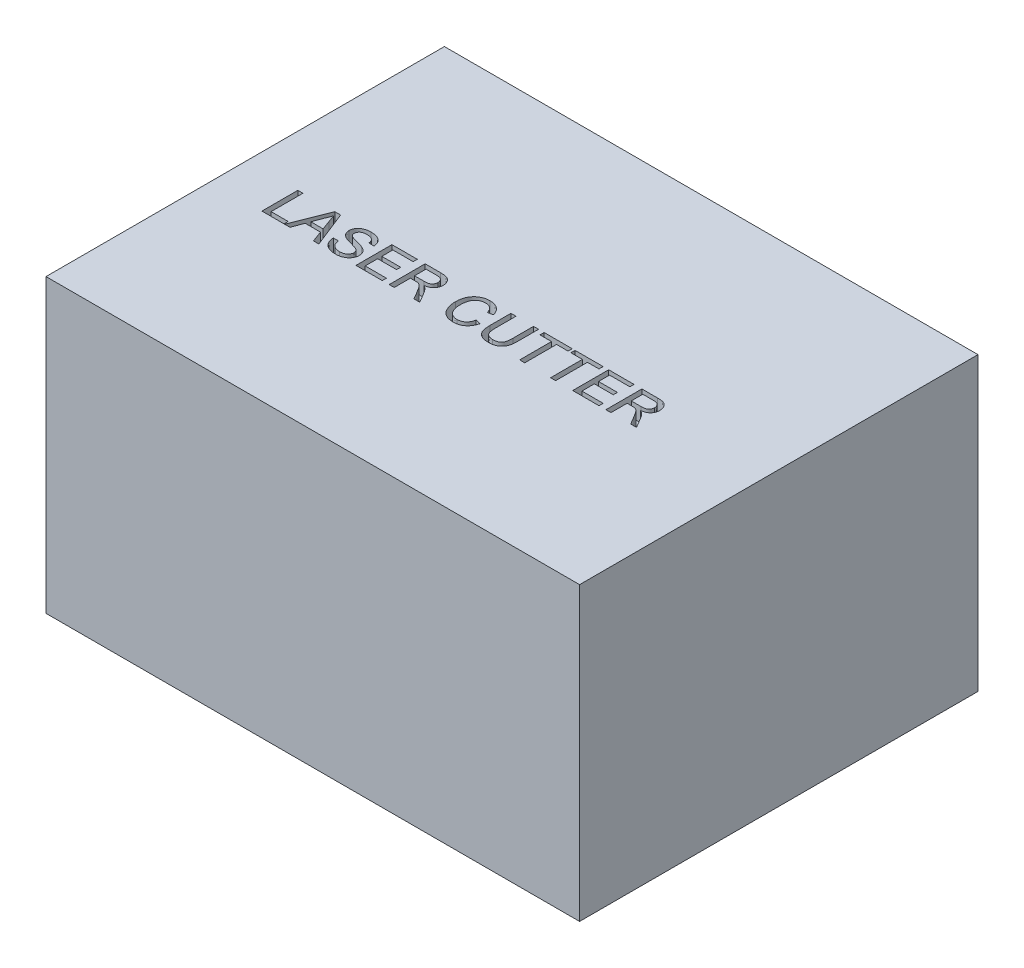
from build123d import *

# Parameters (mm, degrees)
SKETCH1_W           = 1905
SKETCH1_H           = 1422.4
BOSS_EXTRUDE1_DEPTH = 1041.4
CUT_EXTRUDE1_DEPTH  = 50.8


with BuildPart() as part:
    # Sketch1 → Boss-Extrude1 (new body)
    with BuildSketch(Plane(origin=(0, 0, 0), x_dir=(1, 0, 0), z_dir=(0, 1, 0))):
        with Locations((952.5, 711.2)):
            Rectangle(SKETCH1_W, SKETCH1_H)
    extrude(amount=BOSS_EXTRUDE1_DEPTH)

    # Sketch2 → Cut-Extrude1 (cut)
    # profile 1 of 11: a face of its own
    with BuildSketch(Plane(origin=(0, 1041.4, 0), x_dir=(1, 0, 0), z_dir=(0, 1, 0))):
        Polygon((182.897378467, 587.869249848), (182.897378467, 716.285184093), (201.007317912, 716.285184093), (201.007317912, 602.68647303), (261.922568771, 602.68647303), (261.922568771, 587.869249848), align=None)
    # profile 2 of 11: a face of its own
    with BuildSketch(Plane(origin=(0, 1041.4, 0), x_dir=(1, 0, 0), z_dir=(0, 1, 0))):
        Polygon((264.109138165, 587.869249848), (315.094791545, 716.285184093), (335.519922112, 716.285184093), (386.505575492, 587.869249848), (367.289489177, 587.869249848), (352.678060762, 627.381845001), (297.936652895, 627.381845001), (283.325224479, 587.869249848), align=None)
        with BuildLine():
            Line((303.390214205, 642.199068183), (347.224499452, 642.199068183))
            Line((347.224499452, 642.199068183), (334.748191738, 675.949409875))
            add(Edge.make_bspline(
                [(334.748191738, 675.949409875), (334.269894644, 677.253477084), (333.334733516, 679.803174704), (331.940126535, 683.507670106), (330.666036071, 687.025610989), (329.416685744, 690.306555119), (328.28887489, 693.398161507), (327.249342716, 696.279547752), (326.221254169, 698.930686841), (325.604283769, 700.643595861), (325.307356828, 701.467960911)],
                knots=[0, 0, 0, 0, 1.225184869, 2.395467751, 3.491410812, 4.525364584, 5.492066482, 6.394148129, 7.227157926, 8, 8, 8, 8], degree=3))
            add(Edge.make_bspline(
                [(325.307356828, 701.467960911), (324.816182356, 699.435149294), (323.831808147, 695.36114414), (321.770768218, 689.392180055), (319.413010122, 683.47780484), (317.498229605, 679.666621825), (316.53535491, 677.750114081)],
                knots=[0, 0, 0, 0, 0.9891762, 1.982431084, 2.985436691, 4, 4, 4, 4], degree=3))
            Line((316.53535491, 677.750114081), (303.390214205, 642.199068183))
        make_face(mode=Mode.SUBTRACT)
    # profile 3 of 11: a face of its own
    with BuildSketch(Plane(origin=(0, 1041.4, 0), x_dir=(1, 0, 0), z_dir=(0, 1, 0))):
        with BuildLine():
            Line((393.631219279, 632.320919395), (411.741158724, 632.320919395))
            add(Edge.make_bspline(
                [(411.741158724, 632.320919395), (411.940357551, 630.694895863), (412.323029225, 627.5712171), (413.393017448, 623.143872682), (414.770161329, 619.163235682), (416.48604464, 615.576476019), (418.743223757, 612.426598726), (421.462736326, 609.585457511), (424.765436332, 607.125201257), (428.493431766, 604.935734382), (432.645378274, 603.216656596), (437.077951468, 601.942275935), (441.770011839, 601.18719524), (444.982846033, 601.089830781), (446.623371632, 601.040114899)],
                knots=[0, 0, 0, 0, 1.125557648, 2.162256852, 3.1243583, 4.018160113, 4.88511607, 5.777380551, 6.711250965, 7.707237736, 8.743031335, 9.791730543, 10.872421559, 12, 12, 12, 12], degree=3))
            add(Edge.make_bspline(
                [(446.623371632, 601.040114899), (448.0750955, 601.066984762), (450.905675933, 601.119375791), (455.000426917, 601.748721848), (458.853599492, 602.641432323), (462.393482097, 603.991796681), (465.607016465, 605.631562418), (468.397611047, 607.614897529), (470.780072259, 609.851554717), (472.645712079, 612.40044629), (474.11132147, 615.071258414), (475.186497467, 617.816577825), (475.826957773, 620.62116674), (475.908569072, 622.508238756), (475.949125846, 623.446020093)],
                knots=[0, 0, 0, 0, 1.267006637, 2.470417599, 3.611360613, 4.716023143, 5.771382139, 6.754486395, 7.697536124, 8.612899418, 9.501261124, 10.352596716, 11.181322154, 12, 12, 12, 12], degree=3))
            add(Edge.make_bspline(
                [(475.949125846, 623.446020093), (475.905769901, 624.374302245), (475.821030769, 626.188628388), (475.268809314, 628.830060612), (474.219234405, 631.24773834), (472.857290344, 633.540339907), (470.962593615, 635.636427343), (468.568858118, 637.567784944), (465.623343853, 639.318772449), (463.424960595, 640.27771527), (462.263773879, 640.784229163)],
                knots=[0, 0, 0, 0, 0.942140154, 1.841411588, 2.718743672, 3.605002079, 4.535543111, 5.568170452, 6.715506882, 8, 8, 8, 8], degree=3))
            add(Edge.make_bspline(
                [(462.263773879, 640.784229163), (461.811358362, 640.969885562), (460.789269522, 641.389317092), (459.037457211, 641.944572222), (456.958710052, 642.662573762), (454.503087815, 643.401998492), (451.683736524, 644.184206442), (448.505350117, 645.069547249), (444.969704624, 646.011058737), (441.177077055, 647.013195163), (437.347678944, 648.032214228), (433.689136421, 649.052187586), (430.323103372, 650.087591197), (427.222007443, 651.084541925), (424.401836195, 652.08560575), (421.854585333, 653.063375696), (419.577079055, 653.998014108), (418.186064922, 654.685239397), (417.529136529, 655.009792392)],
                knots=[0, 0, 0, 0, 0.499201778, 1.127787504, 1.87543728, 2.745208432, 3.745951656, 4.863402235, 6.114490242, 7.482339553, 8.869366102, 10.161191451, 11.360587006, 12.46547846, 13.487450326, 14.41601931, 15.251940103, 16, 16, 16, 16], degree=3))
            add(Edge.make_bspline(
                [(417.529136529, 655.009792392), (416.017727529, 655.826299072), (413.100314813, 657.402369461), (409.173800414, 660.220387726), (405.865313423, 663.34750057), (403.188811698, 666.779173547), (401.091342029, 670.457368828), (399.676188415, 674.388339379), (398.706925011, 678.500730742), (398.61634482, 681.328644552), (398.570293673, 682.766361513)],
                knots=[0, 0, 0, 0, 1.158441928, 2.236094408, 3.251151369, 4.220012324, 5.163146324, 6.095083285, 7.031536583, 8, 8, 8, 8], degree=3))
            add(Edge.make_bspline(
                [(398.570293673, 682.766361513), (398.631412706, 684.358390196), (398.75297802, 687.524923693), (399.831328976, 692.171614198), (401.551319381, 696.642966437), (403.509190816, 700.192838568), (405.418548125, 702.877235987), (407.001419838, 704.810489936), (408.776920048, 706.597523308), (410.690369521, 708.263281883), (412.775973106, 709.7828773), (414.98198677, 711.21876302), (417.388255885, 712.452941254), (420.769421842, 714.023771576), (425.292607189, 715.592392547), (430.986731799, 716.959246754), (436.979610982, 717.764158778), (441.064498219, 717.874958549), (443.150584948, 717.931542224)],
                knots=[0, 0, 0, 0, 1.199927478, 2.386647047, 3.578628709, 4.806592355, 5.433127754, 6.062729195, 6.689531802, 7.331674828, 7.974827539, 8.635320743, 9.315455226, 10.01318112, 11.447700238, 12.918145351, 14.426146008, 16, 16, 16, 16], degree=3))
            add(Edge.make_bspline(
                [(443.150584948, 717.931542224), (445.433945437, 717.879222506), (449.880088271, 717.777345933), (456.340459481, 716.929751404), (462.366217233, 715.474208561), (467.091823209, 713.844874383), (470.585408444, 712.195394597), (473.067348673, 710.90832227), (475.371079997, 709.420232197), (477.517340645, 707.809885939), (479.526066474, 706.078018933), (481.34562872, 704.183435787), (483.05503785, 702.190776248), (485.063831784, 699.329941484), (487.229737514, 695.543642859), (489.102457836, 690.638342599), (490.389038542, 685.461200925), (490.639308095, 681.88211034), (490.766349028, 680.065305204)],
                knots=[0, 0, 0, 0, 1.607600973, 3.130308851, 4.577334065, 5.967726088, 6.640410691, 7.296826776, 7.935019992, 8.569057421, 9.185393759, 9.8003086, 10.417295362, 11.032210203, 12.259799365, 13.477607022, 14.719591916, 16, 16, 16, 16], degree=3))
            Line((490.766349028, 680.065305204), (472.656409583, 680.065305204))
            add(Edge.make_bspline(
                [(472.656409583, 680.065305204), (472.541341697, 680.984843407), (472.316187946, 682.784107141), (471.757611379, 685.388812083), (470.974599433, 687.807944824), (470.057452478, 690.064065416), (468.945678355, 692.133707721), (467.649671434, 694.036744833), (466.153649099, 695.750755727), (464.496105579, 697.321031143), (462.626602128, 698.688302695), (460.554744838, 699.875136377), (458.277036347, 700.877739073), (455.795483311, 701.69890338), (453.109594432, 702.335602064), (450.213260624, 702.803969771), (447.107601365, 703.043841844), (444.968782213, 703.090412847), (443.870866631, 703.114319042)],
                knots=[0, 0, 0, 0, 1.074487479, 2.102453544, 3.083708351, 4.020042547, 4.923259678, 5.803182661, 6.684453325, 7.556870173, 8.445961597, 9.363679789, 10.320905216, 11.327237703, 12.390948353, 13.519046902, 14.726457512, 16, 16, 16, 16], degree=3))
            add(Edge.make_bspline(
                [(443.870866631, 703.114319042), (442.729634593, 703.105716975), (440.520490041, 703.089065487), (437.326921065, 702.785529681), (434.366895425, 702.369067787), (431.64549728, 701.75475108), (429.171641574, 700.950608448), (426.908612742, 700.022008232), (424.919744047, 698.845229228), (423.158671529, 697.53445047), (421.639523433, 696.084146184), (420.33024281, 694.555876116), (419.172285225, 692.994541939), (418.272526639, 691.314800105), (417.539987913, 689.580264986), (417.067419944, 687.758333005), (416.732830782, 685.882705169), (416.698007951, 684.602926685), (416.680233118, 683.94968142)],
                knots=[0, 0, 0, 0, 1.464176581, 2.834285765, 4.113735764, 5.29917439, 6.409476712, 7.449999357, 8.431575861, 9.367089851, 10.262376129, 11.120706676, 11.948504824, 12.751342953, 13.560717798, 14.359016663, 15.162382702, 16, 16, 16, 16], degree=3))
            add(Edge.make_bspline(
                [(416.680233118, 683.94968142), (416.727033464, 682.844847167), (416.817868621, 680.700465751), (417.745428383, 677.653946165), (419.172021787, 674.876846167), (420.577443594, 673.365840241), (421.284891016, 672.605244921)],
                knots=[0, 0, 0, 0, 1.050964922, 2.039826012, 3.013306874, 4, 4, 4, 4], degree=3))
            add(Edge.make_bspline(
                [(421.284891016, 672.605244921), (421.730858329, 672.225135774), (422.717087506, 671.384547865), (424.552118918, 670.272128187), (426.827285721, 669.148169874), (429.557790205, 668.030868335), (432.73893444, 666.906659647), (436.365587178, 665.749148555), (440.451561912, 664.59952363), (444.872338683, 663.491669802), (449.338354041, 662.379362317), (453.582570076, 661.27129416), (457.479478812, 660.221150471), (461.022897519, 659.196907321), (464.216493748, 658.201460899), (467.049168581, 657.213955319), (469.543839428, 656.305700672), (471.072120042, 655.666669374), (471.781781826, 655.369933233)],
                knots=[0, 0, 0, 0, 0.523891492, 1.158553688, 1.913783773, 2.794766643, 3.797521443, 4.933638669, 6.202080764, 7.596537849, 9.013317056, 10.322179469, 11.523240428, 12.626146501, 13.623953177, 14.517289671, 15.311498917, 16, 16, 16, 16], degree=3))
            add(Edge.make_bspline(
                [(471.781781826, 655.369933233), (472.705087826, 654.944229875), (474.517382774, 654.108645523), (477.084741246, 652.682010941), (479.480365234, 651.20052773), (481.684899698, 649.624309359), (483.691216311, 647.950040291), (485.521748039, 646.196903968), (487.187550649, 644.3747533), (488.621409165, 642.425268857), (489.908867002, 640.427257582), (491.035478341, 638.352794701), (491.942604154, 636.189680693), (492.738210073, 633.963989891), (493.310478936, 631.650966139), (493.75925315, 629.27397252), (494.021015645, 626.821836474), (494.046272428, 625.161585028), (494.059065291, 624.32064785)],
                knots=[0, 0, 0, 0, 1.198900896, 2.353241543, 3.461831299, 4.520043694, 5.547003373, 6.541368882, 7.508191797, 8.454912692, 9.392021408, 10.310662301, 11.235020644, 12.156274873, 13.095836685, 14.042125239, 15.00831306, 16, 16, 16, 16], degree=3))
            add(Edge.make_bspline(
                [(494.059065291, 624.32064785), (493.992047447, 622.6423658), (493.858994752, 619.310418118), (492.713363065, 614.398973136), (490.913636277, 609.639810364), (488.803010816, 605.863152543), (486.807831816, 602.978334817), (485.131787343, 600.904859678), (483.273150383, 598.987615946), (481.277678692, 597.166540014), (479.129879314, 595.47878778), (476.811644968, 593.923784536), (474.34744352, 592.485342837), (470.828625819, 590.732517392), (466.15505133, 588.898895533), (460.201855659, 587.371917345), (453.927908491, 586.381328837), (449.619829083, 586.276433942), (447.420826351, 586.222891717)],
                knots=[0, 0, 0, 0, 1.197055466, 2.376552968, 3.581957237, 4.820753935, 5.454298064, 6.085440993, 6.72202542, 7.359198513, 8.013298489, 8.67051481, 9.351020706, 10.049282741, 11.476266879, 12.925760103, 14.430794493, 16, 16, 16, 16], degree=3))
            add(Edge.make_bspline(
                [(447.420826351, 586.222891717), (446.022654775, 586.234430067), (443.283836389, 586.257032045), (439.25944866, 586.530749137), (435.402804346, 586.926694362), (431.717688206, 587.516459183), (428.2156564, 588.290198603), (424.884138223, 589.21931011), (421.715237036, 590.289373561), (418.720025081, 591.547749633), (415.906321113, 593.009845168), (413.223531892, 594.587076315), (410.715509391, 596.374941736), (408.376973908, 598.345347854), (406.148671932, 600.44137139), (404.122959947, 602.748612226), (402.23096892, 605.199598324), (400.515930301, 607.816762044), (398.983804392, 610.565862226), (397.605986692, 613.400730688), (396.445156002, 616.341932186), (395.509636924, 619.374601953), (394.717204899, 622.478445325), (394.167671605, 625.679358465), (393.763636216, 628.967291661), (393.675618972, 631.196440567), (393.631219279, 632.320919395)],
                knots=[0, 0, 0, 0, 1.259822038, 2.467811403, 3.633536148, 4.752793854, 5.829021491, 6.863980041, 7.868367876, 8.841470325, 9.788447787, 10.724101269, 11.643985084, 12.560193707, 13.478453146, 14.398077254, 15.323914234, 16.266973849, 17.21495974, 18.158525798, 19.105629373, 20.061269543, 21.017128399, 21.990322895, 22.986232211, 24, 24, 24, 24], degree=3))
        make_face()
    # profile 4 of 11: a face of its own
    with BuildSketch(Plane(origin=(0, 1041.4, 0), x_dir=(1, 0, 0), z_dir=(0, 1, 0))):
        Polygon((518.754437261, 587.869249848), (518.754437261, 716.285184093), (609.304134485, 716.285184093), (609.304134485, 701.467960911), (536.864376706, 701.467960911), (536.864376706, 661.955365759), (604.365060091, 661.955365759), (604.365060091, 647.138142577), (536.864376706, 647.138142577), (536.864376706, 602.68647303), (612.596850748, 602.68647303), (612.596850748, 587.869249848), align=None)
    # profile 5 of 11: a face of its own
    with BuildSketch(Plane(origin=(0, 1041.4, 0), x_dir=(1, 0, 0), z_dir=(0, 1, 0))):
        with BuildLine():
            Line((637.292222718, 587.869249848), (637.292222718, 716.285184093))
            Line((637.292222718, 716.285184093), (693.011155725, 716.285184093))
            add(Edge.make_bspline(
                [(693.011155725, 716.285184093), (694.323165987, 716.27490395), (696.862408284, 716.255007936), (700.544833911, 716.114166751), (703.982009073, 715.810550104), (707.180253586, 715.482231015), (710.138999212, 714.978305064), (712.855193495, 714.400313383), (715.333030101, 713.712494543), (717.583586459, 712.90012747), (719.671612023, 711.981055827), (721.607054001, 710.847069804), (723.470366223, 709.604462916), (725.19239467, 708.144585264), (726.818558012, 706.54615436), (728.347349069, 704.78745092), (729.756135307, 702.853212977), (731.493704418, 700.084917354), (733.357761814, 696.398130544), (734.910814417, 691.679842271), (735.912194953, 686.744340518), (736.019345531, 683.371496818), (736.073710598, 681.660214643)],
                knots=[0, 0, 0, 0, 1.242255013, 2.404239178, 3.487702428, 4.508875116, 5.447164253, 6.327763259, 7.137389581, 7.87956647, 8.591787438, 9.293660819, 10.000726923, 10.709654955, 11.427269343, 12.158170644, 12.913245971, 13.690346794, 15.251572448, 16.809945773, 18.381459854, 20, 20, 20, 20], degree=3))
            add(Edge.make_bspline(
                [(736.073710598, 681.660214643), (736.048581831, 680.561724104), (735.998950793, 678.392129958), (735.618772045, 675.202245829), (734.930869296, 672.154439815), (734.048769609, 669.222019778), (732.841444238, 666.446533423), (731.4428102, 663.771290595), (729.710101477, 661.269787351), (727.770142456, 658.875412672), (725.545529685, 656.639447671), (723.016693296, 654.642560466), (720.208701062, 652.846356428), (717.108328467, 651.300393525), (713.751263917, 649.887310035), (710.095385473, 648.749427124), (706.155447956, 647.820258472), (703.424100126, 647.370319154), (702.014676756, 647.138142577)],
                knots=[0, 0, 0, 0, 0.982609109, 1.940720374, 2.867584677, 3.775009516, 4.675469332, 5.571146231, 6.471115823, 7.392408543, 8.32534739, 9.286126426, 10.269214477, 11.301811357, 12.381622301, 13.524260118, 14.722474812, 16, 16, 16, 16], degree=3))
            add(Edge.make_bspline(
                [(702.014676756, 647.138142577), (703.048542194, 646.615856562), (705.011889881, 645.624016617), (707.730169082, 644.068820198), (710.034360265, 642.479792691), (711.369294977, 641.343273509), (711.995722928, 640.809953509)],
                knots=[0, 0, 0, 0, 1.172304973, 2.226249348, 3.167654437, 4, 4, 4, 4], degree=3))
            add(Edge.make_bspline(
                [(711.995722928, 640.809953509), (713.208836045, 639.620748142), (715.700656569, 637.178035833), (719.134493487, 633.017381213), (722.46371631, 628.385934178), (724.486470196, 625.038771709), (725.526728819, 623.317398364)],
                knots=[0, 0, 0, 0, 0.918110279, 1.885863737, 2.912745394, 4, 4, 4, 4], degree=3))
            Line((725.526728819, 623.317398364), (746.594968032, 587.869249848))
            Line((746.594968032, 587.869249848), (725.835420969, 587.869249848))
            Line((725.835420969, 587.869249848), (709.83487788, 614.982710324))
            add(Edge.make_bspline(
                [(709.83487788, 614.982710324), (709.259578721, 615.934018675), (708.144743413, 617.777498055), (706.534403751, 620.469810946), (704.955518657, 622.948513937), (703.491129739, 625.284449709), (702.08180964, 627.435210501), (700.741175692, 629.408267635), (699.506122735, 631.229505044), (697.976349975, 633.349899347), (696.195948562, 635.69613532), (694.11834227, 638.112315321), (692.139845092, 640.03870345), (689.703289305, 641.927731929), (686.685246341, 643.694600544), (684.119852851, 644.506428133), (682.875763479, 644.900124492)],
                knots=[0, 0, 0, 0, 1.130940588, 2.191577161, 3.191089816, 4.120344442, 4.99615009, 5.80661983, 6.546979556, 7.234477901, 8.466216387, 9.541989141, 10.473533583, 11.269175393, 12.675684693, 14, 14, 14, 14], degree=3))
            add(Edge.make_bspline(
                [(682.875763479, 644.900124492), (682.353789689, 644.994254106), (681.162107877, 645.209154838), (679.138635133, 645.349506848), (676.686949662, 645.498471729), (674.910171419, 645.494131392), (673.949415486, 645.491784445)],
                knots=[0, 0, 0, 0, 0.709978628, 1.620902492, 2.713552433, 4, 4, 4, 4], degree=3))
            Line((673.949415486, 645.491784445), (655.402162163, 645.491784445))
            Line((655.402162163, 645.491784445), (655.402162163, 587.869249848))
            Line((655.402162163, 587.869249848), (637.292222718, 587.869249848))
        make_face()
        with BuildLine():
            Line((655.402162163, 660.309007627), (689.7956125, 660.309007627))
            add(Edge.make_bspline(
                [(689.7956125, 660.309007627), (691.520230378, 660.33599091), (694.744241743, 660.386433625), (699.252511599, 660.817161395), (703.094560608, 661.501606114), (706.346340593, 662.499948895), (709.078349062, 663.885980201), (711.454428735, 665.575118349), (713.428980854, 667.69093972), (715.071604246, 670.078193668), (716.348449107, 672.705247474), (717.26950409, 675.464582334), (717.872350596, 678.333007824), (717.933027733, 680.285218503), (717.963771154, 681.274349456)],
                knots=[0, 0, 0, 0, 1.546323217, 2.890706218, 4.056530419, 5.041445823, 5.928701482, 6.793137403, 7.641659452, 8.509781392, 9.383301667, 10.251423607, 11.114044887, 12, 12, 12, 12], degree=3))
            add(Edge.make_bspline(
                [(717.963771154, 681.274349456), (717.939869428, 681.995166794), (717.893052969, 683.407036208), (717.647625606, 685.479268518), (717.170456544, 687.448368191), (716.540355968, 689.32474411), (715.698413737, 691.094653162), (714.698220713, 692.771810186), (713.504681665, 694.3469197), (712.13755136, 695.824779729), (710.567837324, 697.169487929), (708.774854864, 698.329679445), (706.772745127, 699.315591943), (704.559180985, 700.098078009), (702.141135572, 700.723939488), (699.504843486, 701.140304944), (696.662361054, 701.4415856), (694.69268557, 701.459004888), (693.679988716, 701.467960911)],
                knots=[0, 0, 0, 0, 0.965208469, 1.890559848, 2.786986821, 3.67262109, 4.535197034, 5.405224191, 6.282113641, 7.175449223, 8.095446547, 9.040936516, 10.026471658, 11.075712529, 12.17809725, 13.364958037, 14.645208957, 16, 16, 16, 16], degree=3))
            Line((693.679988716, 701.467960911), (655.402162163, 701.467960911))
            Line((655.402162163, 701.467960911), (655.402162163, 660.309007627))
        make_face(mode=Mode.SUBTRACT)
    # profile 6 of 11: a face of its own
    with BuildSketch(Plane(origin=(0, 1041.4, 0), x_dir=(1, 0, 0), z_dir=(0, 1, 0))):
        with BuildLine():
            Line((902.355881864, 633.195547152), (920.465821309, 628.97675444))
            add(Edge.make_bspline(
                [(920.465821309, 628.97675444), (920.012116773, 627.279360125), (919.124614389, 623.959046172), (917.36991437, 619.207309369), (915.400478791, 614.748007065), (913.168520228, 610.592885856), (910.6496101, 606.765835106), (907.910489349, 603.217669832), (904.842665258, 600.022798416), (901.558699958, 597.107484894), (898.033024194, 594.536186147), (894.308145537, 592.315822508), (890.40206925, 590.426743765), (886.299008188, 588.873281401), (881.996302303, 587.704167782), (877.516106296, 586.852049283), (872.845356213, 586.327193917), (869.661612798, 586.258095165), (868.039604564, 586.222891717)],
                knots=[0, 0, 0, 0, 1.145254194, 2.240259345, 3.299159039, 4.322497661, 5.312016644, 6.284080175, 7.241264552, 8.196044782, 9.144516039, 10.082428046, 11.020306713, 11.970622414, 12.939253955, 13.924100776, 14.94240044, 16, 16, 16, 16], degree=3))
            add(Edge.make_bspline(
                [(868.039604564, 586.222891717), (866.375392699, 586.247069727), (863.119495175, 586.294372072), (858.349793014, 586.679116778), (853.813337897, 587.346396594), (849.518601551, 588.273486401), (845.451128404, 589.419775313), (841.627785158, 590.861908338), (838.055268532, 592.589479954), (834.703778989, 594.554175357), (831.587551449, 596.786157808), (828.635721808, 599.225192165), (825.919950675, 601.938422351), (823.372333502, 604.861786484), (821.048358315, 608.033847799), (818.862525561, 611.41151251), (816.921524476, 615.054294928), (815.153423061, 618.894657773), (813.601522657, 622.895419434), (812.228633624, 626.977553817), (811.106221786, 631.149195015), (810.139897623, 635.375239393), (809.437909942, 639.691246208), (808.880553457, 644.064832202), (808.574107656, 648.522811241), (808.533782622, 651.519432205), (808.513468378, 653.029017765)],
                knots=[0, 0, 0, 0, 1.180702053, 2.309949215, 3.392367133, 4.431746864, 5.425408375, 6.388154007, 7.326956194, 8.237882283, 9.141054626, 10.043899035, 10.951650021, 11.86168169, 12.792564695, 13.739356664, 14.713891418, 15.718426911, 16.737522708, 17.757217648, 18.772674716, 19.801476837, 20.831699174, 21.873853055, 22.928926693, 24, 24, 24, 24], degree=3))
            add(Edge.make_bspline(
                [(808.513468378, 653.029017765), (808.542522026, 654.658676251), (808.599924697, 657.878469815), (808.923961844, 662.629368679), (809.51910063, 667.214567283), (810.345575298, 671.63708167), (811.391396388, 675.900493444), (812.682345293, 680.006879718), (814.202091563, 683.950986417), (815.946002006, 687.737162708), (817.925662854, 691.323144879), (820.081989331, 694.714030695), (822.466418102, 697.854143319), (825.008254403, 700.803475467), (827.770982298, 703.512917449), (830.74616563, 705.988606785), (833.908135785, 708.2531249), (837.256431233, 710.28544892), (840.747285854, 712.068706914), (844.328849223, 713.657070348), (848.015366739, 714.958950093), (851.777610651, 716.041410767), (855.623680728, 716.903150018), (859.56256373, 717.479397744), (863.590620065, 717.854925408), (866.306650236, 717.905818424), (867.679463723, 717.931542224)],
                knots=[0, 0, 0, 0, 1.185634383, 2.342514083, 3.462112933, 4.547331452, 5.613960142, 6.653690668, 7.676612054, 8.686959706, 9.683658101, 10.654407272, 11.607580201, 12.5494388, 13.484601218, 14.419076806, 15.362504069, 16.311442244, 17.265594461, 18.212500624, 19.159571152, 20.107257795, 21.059246075, 22.024387127, 23.001429356, 24, 24, 24, 24], degree=3))
            add(Edge.make_bspline(
                [(867.679463723, 717.931542224), (869.215457073, 717.90258951), (872.23460409, 717.845680082), (876.664664429, 717.377588815), (880.90750557, 716.593587218), (884.981512507, 715.565051266), (888.844328553, 714.156771442), (892.537891242, 712.482488589), (896.025456942, 710.471040551), (899.334161888, 708.17770556), (902.410145445, 705.598254169), (905.296452734, 702.794308766), (907.875395305, 699.69579117), (910.249114963, 696.377691029), (912.342926571, 692.793997617), (914.233859342, 688.975956891), (915.860006489, 684.895186086), (916.730076199, 682.052816346), (917.173105046, 680.605516465)],
                knots=[0, 0, 0, 0, 1.098391872, 2.158997981, 3.181470371, 4.182549255, 5.160268219, 6.118029851, 7.079534476, 8.035645336, 8.993622929, 9.94770573, 10.909620999, 11.872786677, 12.862530088, 13.874594564, 14.917769567, 16, 16, 16, 16], degree=3))
            Line((917.173105046, 680.605516465), (899.063165601, 676.721140249))
            add(Edge.make_bspline(
                [(899.063165601, 676.721140249), (898.707514659, 677.831868597), (898.011395721, 680.005907653), (896.775368452, 683.104299675), (895.440500212, 685.980619771), (893.974993344, 688.615316011), (892.375671787, 691.009019483), (890.679363668, 693.190822094), (888.845427144, 695.120000164), (886.911166016, 696.841035743), (884.826631985, 698.307193359), (882.640695579, 699.606450289), (880.307266356, 700.681387272), (877.859912414, 701.590561898), (875.275758596, 702.282541755), (872.565327919, 702.769376881), (869.726238936, 703.0511332), (867.791559256, 703.092977604), (866.804835965, 703.114319042)],
                knots=[0, 0, 0, 0, 1.235697765, 2.418642872, 3.532555292, 4.594392283, 5.610119701, 6.580908344, 7.519430642, 8.427315627, 9.319973334, 10.216139639, 11.118687699, 12.038725643, 12.980015607, 13.949697744, 14.954307006, 16, 16, 16, 16], degree=3))
            add(Edge.make_bspline(
                [(866.804835965, 703.114319042), (865.671987359, 703.097882534), (863.444008464, 703.065556773), (860.170839444, 702.711754907), (857.027458727, 702.190639282), (854.037293821, 701.409181604), (851.183982331, 700.434907093), (848.484456309, 699.221762942), (845.915752381, 697.799815696), (843.506538593, 696.160526387), (841.277062209, 694.317649721), (839.166821691, 692.369440741), (837.277131998, 690.225039431), (835.535933602, 687.955155195), (833.99393014, 685.519677536), (832.605868713, 682.951780607), (831.380597155, 680.230418477), (830.044967954, 676.4003074), (828.68311497, 671.467212914), (827.501705826, 665.430704167), (826.749176055, 659.299090638), (826.665419211, 655.174855628), (826.623407822, 653.106190803)],
                knots=[0, 0, 0, 0, 0.935256702, 1.839373932, 2.716087708, 3.564631604, 4.388828665, 5.203538865, 6.005592122, 6.810952829, 7.606223804, 8.392839071, 9.180346482, 9.963639178, 10.753404291, 11.558266631, 12.372976832, 13.215232055, 14.905983541, 16.594894834, 18.292041732, 20, 20, 20, 20], degree=3))
            add(Edge.make_bspline(
                [(826.623407822, 653.106190803), (826.670790706, 650.505190976), (826.762717791, 645.459015767), (827.669812172, 638.146274363), (829.052801946, 631.325455007), (830.721871354, 626.003856867), (832.396115668, 622.078545882), (833.750160347, 619.32959399), (835.295748329, 616.785847269), (836.994435209, 614.43285947), (838.868101855, 612.277494191), (840.8906443, 610.30830198), (843.062514323, 608.506334571), (845.409446567, 606.955945333), (847.84110466, 605.579334881), (850.326803037, 604.355226579), (852.86810672, 603.319929955), (855.475268796, 602.515690511), (858.111677735, 601.820715821), (860.806370865, 601.366725736), (863.558579765, 601.110508035), (865.406619989, 601.06376741), (866.341797741, 601.040114899)],
                knots=[0, 0, 0, 0, 2.10686522, 4.087509323, 5.961373225, 7.741398778, 8.594514555, 9.418024779, 10.222433421, 11.003575649, 11.767087398, 12.533660211, 13.289033706, 14.050297079, 14.809623433, 15.552362432, 16.294320901, 17.0305302, 17.761969017, 18.502233515, 19.242073914, 20, 20, 20, 20], degree=3))
            add(Edge.make_bspline(
                [(866.341797741, 601.040114899), (867.457804337, 601.063519905), (869.662311971, 601.109753067), (872.894400083, 601.514434535), (876.010088465, 602.110785611), (878.97163099, 603.03101554), (881.818863751, 604.157729272), (884.528458553, 605.547164353), (887.091894142, 607.218249226), (889.539322152, 609.115609132), (891.825609851, 611.274480473), (893.920869616, 613.677470334), (895.800554356, 616.335533592), (897.543495123, 619.206012214), (899.007885703, 622.374657997), (900.364257151, 625.74702756), (901.494483823, 629.378548792), (902.064624483, 631.904937128), (902.355881864, 633.195547152)],
                knots=[0, 0, 0, 0, 1.013374089, 2.001772144, 2.95501459, 3.891367103, 4.814208647, 5.733921849, 6.652182523, 7.590185968, 8.54346024, 9.504121027, 10.481158517, 11.497760682, 12.549996529, 13.647863555, 14.798406869, 16, 16, 16, 16], degree=3))
        make_face()
    # profile 7 of 11: a face of its own
    with BuildSketch(Plane(origin=(0, 1041.4, 0), x_dir=(1, 0, 0), z_dir=(0, 1, 0))):
        with BuildLine():
            Line((1024.186383584, 716.285184093), (1042.296323028, 716.285184093))
            Line((1042.296323028, 716.285184093), (1042.296323028, 642.404862949))
            add(Edge.make_bspline(
                [(1042.296323028, 642.404862949), (1042.277529335, 640.835545533), (1042.240956778, 637.781651271), (1042.072707274, 633.327892981), (1041.744949635, 629.121608123), (1041.243159958, 625.169599286), (1040.675885007, 621.454725604), (1039.920362804, 617.997296013), (1039.053840769, 614.783356489), (1038.056826528, 611.791192976), (1036.850033466, 609.000591151), (1035.471268827, 606.351793587), (1033.863406821, 603.837066715), (1032.03061751, 601.460227272), (1029.963176423, 599.234267181), (1027.717537366, 597.102125988), (1025.234420472, 595.122417191), (1022.541141823, 593.272478827), (1019.63435684, 591.593513456), (1016.501340258, 590.144963808), (1013.145914012, 588.950668629), (1009.583229508, 587.934640737), (1005.795500936, 587.1813651), (1001.794879572, 586.609991238), (997.576068834, 586.273916882), (994.689735344, 586.240151986), (993.214271238, 586.222891717)],
                knots=[0, 0, 0, 0, 1.311435591, 2.552055809, 3.723716842, 4.835547674, 5.880436826, 6.862821995, 7.791032428, 8.661143393, 9.495683908, 10.328993084, 11.1538804, 11.986573222, 12.833449924, 13.690091648, 14.571895854, 15.484149563, 16.418232274, 17.373591634, 18.364096258, 19.391643703, 20.466661433, 21.588422397, 22.767226238, 24, 24, 24, 24], degree=3))
            add(Edge.make_bspline(
                [(993.214271238, 586.222891717), (991.773300557, 586.244102746), (988.965681613, 586.28543078), (984.851362796, 586.564890837), (980.93774162, 587.060124636), (977.213006737, 587.710046992), (973.689660785, 588.590863605), (970.372934647, 589.668990998), (967.251504618, 590.930128464), (964.324997478, 592.36500434), (961.627624596, 594.02164493), (959.111699485, 595.829932705), (956.788471341, 597.809557626), (954.679522084, 599.97836273), (952.759847824, 602.30368902), (951.056203508, 604.810387951), (949.564509693, 607.502930336), (948.247256847, 610.374226069), (947.099569968, 613.466540437), (946.174120776, 616.822016673), (945.336866667, 620.432042147), (944.694257067, 624.309732345), (944.129793764, 628.450218146), (943.802457834, 632.865736188), (943.553060597, 637.54868973), (943.527797501, 640.7581215), (943.514835148, 642.404862949)],
                knots=[0, 0, 0, 0, 1.192889473, 2.324252067, 3.41162405, 4.457325556, 5.452435892, 6.415456921, 7.342133401, 8.237363544, 9.110250727, 9.959377435, 10.800155199, 11.633438097, 12.46053001, 13.293359256, 14.138649731, 15.005774073, 15.906391469, 16.865847877, 17.8852706, 18.972920589, 20.118424796, 21.343408205, 22.636917643, 24, 24, 24, 24], degree=3))
            Line((943.514835148, 642.404862949), (943.514835148, 716.285184093))
            Line((943.514835148, 716.285184093), (961.624774592, 716.285184093))
            Line((961.624774592, 716.285184093), (961.624774592, 643.25376636))
            add(Edge.make_bspline(
                [(961.624774592, 643.25376636), (961.636607846, 641.924610476), (961.659440282, 639.359984593), (961.778565338, 635.6448359), (962.016794624, 632.197200366), (962.311309113, 629.011814774), (962.716212021, 626.100182151), (963.234733744, 623.466566678), (963.816342754, 621.101999547), (964.687294523, 618.336751684), (966.132992116, 615.249934411), (968.411308144, 611.978160556), (971.191306759, 609.135780686), (974.499587424, 606.788423409), (978.256511787, 604.923273392), (982.436753934, 603.637229433), (986.990720887, 602.810177011), (990.157797965, 602.728704031), (991.799432219, 602.68647303)],
                knots=[0, 0, 0, 0, 1.090245215, 2.103644224, 3.048223674, 3.924421557, 4.727106666, 5.45815927, 6.12513286, 6.723455763, 7.834131158, 8.905266051, 9.9795367, 11.078391299, 12.21701853, 13.404826756, 14.65480846, 16, 16, 16, 16], degree=3))
            add(Edge.make_bspline(
                [(991.799432219, 602.68647303), (993.206432049, 602.710425794), (995.923206324, 602.756676155), (999.840717627, 603.129669283), (1003.432138442, 603.809643577), (1006.727275689, 604.685908659), (1009.702940898, 605.875922246), (1012.377328108, 607.317691174), (1014.741053313, 609.018974285), (1016.811077958, 611.02586239), (1018.594676803, 613.427481131), (1020.097927099, 616.289628093), (1021.378515773, 619.614797571), (1022.427941777, 623.413966703), (1023.193120348, 627.705179656), (1023.791285261, 632.460798379), (1024.104933507, 637.701730288), (1024.158451987, 641.349811988), (1024.186383584, 643.25376636)],
                knots=[0, 0, 0, 0, 1.111629428, 2.146443922, 3.104513091, 3.997025448, 4.836178689, 5.630482806, 6.392099463, 7.129930272, 7.899580577, 8.745272349, 9.676297551, 10.710246713, 11.854352966, 13.117392195, 14.495550762, 16, 16, 16, 16], degree=3))
            Line((1024.186383584, 643.25376636), (1024.186383584, 716.285184093))
        make_face()
    # profile 8 of 11: a face of its own
    with BuildSketch(Plane(origin=(0, 1041.4, 0), x_dir=(1, 0, 0), z_dir=(0, 1, 0))):
        Polygon((1103.211573888, 587.869249848), (1103.211573888, 701.467960911), (1062.052620604, 701.467960911), (1062.052620604, 716.285184093), (1162.480466616, 716.285184093), (1162.480466616, 701.467960911), (1121.321513333, 701.467960911), (1121.321513333, 587.869249848), align=None)
    # profile 9 of 11: a face of its own
    with BuildSketch(Plane(origin=(0, 1041.4, 0), x_dir=(1, 0, 0), z_dir=(0, 1, 0))):
        Polygon((1213.517568688, 587.869249848), (1213.517568688, 701.467960911), (1172.358615404, 701.467960911), (1172.358615404, 716.285184093), (1272.786461416, 716.285184093), (1272.786461416, 701.467960911), (1231.627508133, 701.467960911), (1231.627508133, 587.869249848), align=None)
    # profile 10 of 11: a face of its own
    with BuildSketch(Plane(origin=(0, 1041.4, 0), x_dir=(1, 0, 0), z_dir=(0, 1, 0))):
        Polygon((1292.542758993, 587.869249848), (1292.542758993, 716.285184093), (1383.092456216, 716.285184093), (1383.092456216, 701.467960911), (1310.652698437, 701.467960911), (1310.652698437, 661.955365759), (1378.153381822, 661.955365759), (1378.153381822, 647.138142577), (1310.652698437, 647.138142577), (1310.652698437, 602.68647303), (1386.385172479, 602.68647303), (1386.385172479, 587.869249848), align=None)
    # profile 11 of 11: a face of its own
    with BuildSketch(Plane(origin=(0, 1041.4, 0), x_dir=(1, 0, 0), z_dir=(0, 1, 0))):
        with BuildLine():
            Line((1411.080544449, 587.869249848), (1411.080544449, 716.285184093))
            Line((1411.080544449, 716.285184093), (1466.799477457, 716.285184093))
            add(Edge.make_bspline(
                [(1466.799477457, 716.285184093), (1468.111487719, 716.27490395), (1470.650730015, 716.255007936), (1474.333155642, 716.114166751), (1477.770330805, 715.810550104), (1480.968575317, 715.482231015), (1483.927320944, 714.978305064), (1486.643515227, 714.400313383), (1489.121351833, 713.712494543), (1491.371908191, 712.90012747), (1493.459933755, 711.981055827), (1495.395375733, 710.847069804), (1497.258687954, 709.604462916), (1498.980716401, 708.144585264), (1500.606879743, 706.54615436), (1502.135670801, 704.78745092), (1503.544457038, 702.853212977), (1505.28202615, 700.084917354), (1507.146083545, 696.398130544), (1508.699136148, 691.679842271), (1509.700516684, 686.744340518), (1509.807667263, 683.371496818), (1509.86203233, 681.660214643)],
                knots=[0, 0, 0, 0, 1.242255013, 2.404239178, 3.487702428, 4.508875116, 5.447164253, 6.327763259, 7.137389581, 7.87956647, 8.591787438, 9.293660819, 10.000726923, 10.709654955, 11.427269343, 12.158170644, 12.913245971, 13.690346794, 15.251572448, 16.809945773, 18.381459854, 20, 20, 20, 20], degree=3))
            add(Edge.make_bspline(
                [(1509.86203233, 681.660214643), (1509.836903563, 680.561724104), (1509.787272524, 678.392129958), (1509.407093776, 675.202245829), (1508.719191028, 672.154439815), (1507.83709134, 669.222019778), (1506.62976597, 666.446533423), (1505.231131932, 663.771290595), (1503.498423209, 661.269787351), (1501.558464187, 658.875412672), (1499.333851417, 656.639447671), (1496.805015027, 654.642560466), (1493.997022793, 652.846356428), (1490.896650198, 651.300393525), (1487.539585648, 649.887310035), (1483.883707204, 648.749427124), (1479.943769688, 647.820258472), (1477.212421858, 647.370319154), (1475.802998488, 647.138142577)],
                knots=[0, 0, 0, 0, 0.982609109, 1.940720374, 2.867584677, 3.775009516, 4.675469332, 5.571146231, 6.471115823, 7.392408543, 8.32534739, 9.286126426, 10.269214477, 11.301811357, 12.381622301, 13.524260118, 14.722474812, 16, 16, 16, 16], degree=3))
            add(Edge.make_bspline(
                [(1475.802998488, 647.138142577), (1476.836863926, 646.615856562), (1478.800211612, 645.624016617), (1481.518490814, 644.068820198), (1483.822681996, 642.479792691), (1485.157616709, 641.343273509), (1485.784044659, 640.809953509)],
                knots=[0, 0, 0, 0, 1.172304973, 2.226249348, 3.167654437, 4, 4, 4, 4], degree=3))
            add(Edge.make_bspline(
                [(1485.784044659, 640.809953509), (1486.997157776, 639.620748142), (1489.4889783, 637.178035833), (1492.922815218, 633.017381213), (1496.252038042, 628.385934178), (1498.274791927, 625.038771709), (1499.315050551, 623.317398364)],
                knots=[0, 0, 0, 0, 0.918110279, 1.885863737, 2.912745394, 4, 4, 4, 4], degree=3))
            Line((1499.315050551, 623.317398364), (1520.383289763, 587.869249848))
            Line((1520.383289763, 587.869249848), (1499.623742701, 587.869249848))
            Line((1499.623742701, 587.869249848), (1483.623199612, 614.982710324))
            add(Edge.make_bspline(
                [(1483.623199612, 614.982710324), (1483.047900452, 615.934018675), (1481.933065144, 617.777498055), (1480.322725482, 620.469810946), (1478.743840388, 622.948513937), (1477.27945147, 625.284449709), (1475.870131372, 627.435210501), (1474.529497423, 629.408267635), (1473.294444467, 631.229505044), (1471.764671707, 633.349899347), (1469.984270293, 635.69613532), (1467.906664001, 638.112315321), (1465.928166824, 640.03870345), (1463.491611036, 641.927731929), (1460.473568072, 643.694600544), (1457.908174582, 644.506428133), (1456.664085211, 644.900124492)],
                knots=[0, 0, 0, 0, 1.130940588, 2.191577161, 3.191089816, 4.120344442, 4.99615009, 5.80661983, 6.546979556, 7.234477901, 8.466216387, 9.541989141, 10.473533583, 11.269175393, 12.675684693, 14, 14, 14, 14], degree=3))
            add(Edge.make_bspline(
                [(1456.664085211, 644.900124492), (1456.14211142, 644.994254106), (1454.950429608, 645.209154838), (1452.926956865, 645.349506848), (1450.475271393, 645.498471729), (1448.698493151, 645.494131392), (1447.737737217, 645.491784445)],
                knots=[0, 0, 0, 0, 0.709978628, 1.620902492, 2.713552433, 4, 4, 4, 4], degree=3))
            Line((1447.737737217, 645.491784445), (1429.190483894, 645.491784445))
            Line((1429.190483894, 645.491784445), (1429.190483894, 587.869249848))
            Line((1429.190483894, 587.869249848), (1411.080544449, 587.869249848))
        make_face()
        with BuildLine():
            Line((1429.190483894, 660.309007627), (1463.583934232, 660.309007627))
            add(Edge.make_bspline(
                [(1463.583934232, 660.309007627), (1465.30855211, 660.33599091), (1468.532563474, 660.386433625), (1473.040833331, 660.817161395), (1476.88288234, 661.501606114), (1480.134662324, 662.499948895), (1482.866670793, 663.885980201), (1485.242750467, 665.575118349), (1487.217302585, 667.69093972), (1488.859925978, 670.078193668), (1490.136770838, 672.705247474), (1491.057825821, 675.464582334), (1491.660672327, 678.333007824), (1491.721349464, 680.285218503), (1491.752092885, 681.274349456)],
                knots=[0, 0, 0, 0, 1.546323217, 2.890706218, 4.056530419, 5.041445823, 5.928701482, 6.793137403, 7.641659452, 8.509781392, 9.383301667, 10.251423607, 11.114044887, 12, 12, 12, 12], degree=3))
            add(Edge.make_bspline(
                [(1491.752092885, 681.274349456), (1491.728191159, 681.995166794), (1491.6813747, 683.407036208), (1491.435947338, 685.479268518), (1490.958778276, 687.448368191), (1490.3286777, 689.32474411), (1489.486735468, 691.094653162), (1488.486542445, 692.771810186), (1487.293003396, 694.3469197), (1485.925873091, 695.824779729), (1484.356159056, 697.169487929), (1482.563176595, 698.329679445), (1480.561066858, 699.315591943), (1478.347502717, 700.098078009), (1475.929457303, 700.723939488), (1473.293165217, 701.140304944), (1470.450682786, 701.4415856), (1468.481007301, 701.459004888), (1467.468310448, 701.467960911)],
                knots=[0, 0, 0, 0, 0.965208469, 1.890559848, 2.786986821, 3.67262109, 4.535197034, 5.405224191, 6.282113641, 7.175449223, 8.095446547, 9.040936516, 10.026471658, 11.075712529, 12.17809725, 13.364958037, 14.645208957, 16, 16, 16, 16], degree=3))
            Line((1467.468310448, 701.467960911), (1429.190483894, 701.467960911))
            Line((1429.190483894, 701.467960911), (1429.190483894, 660.309007627))
        make_face(mode=Mode.SUBTRACT)
    extrude(amount=-CUT_EXTRUDE1_DEPTH, mode=Mode.SUBTRACT)


solid = part.part
